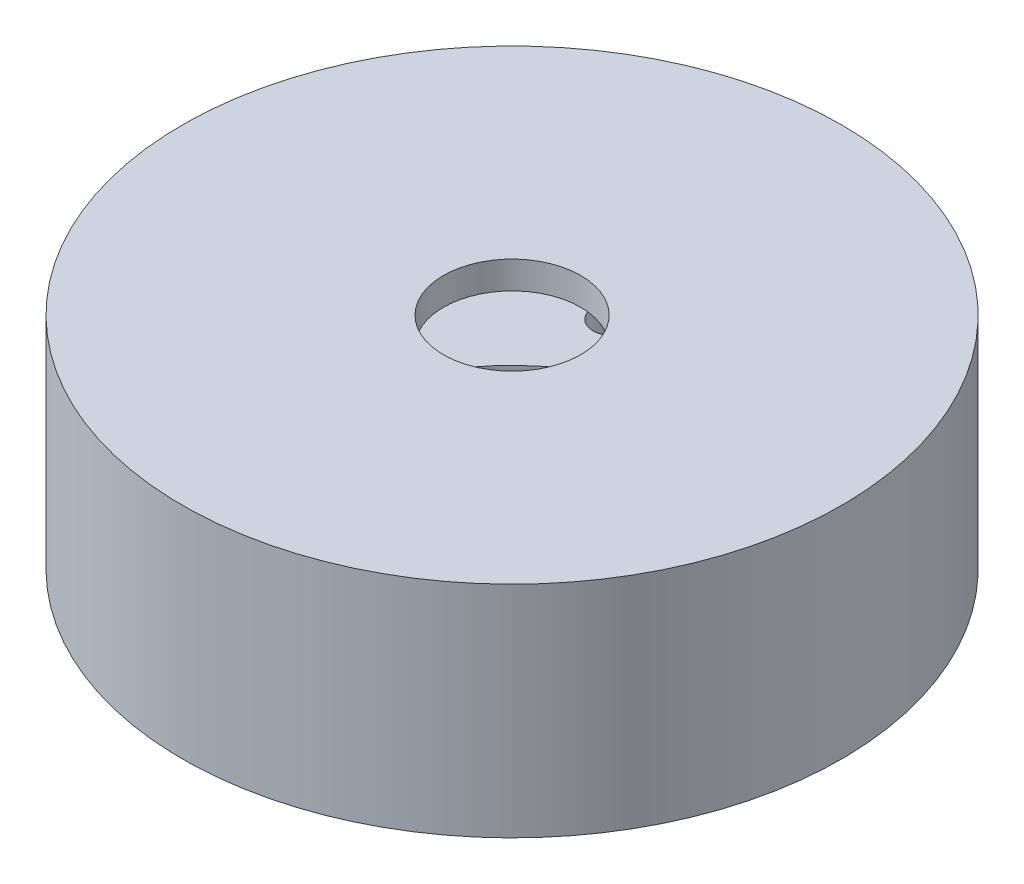
from build123d import *

# Parameters (mm, degrees)
SKETCH1_W          = 139.7
SKETCH1_H          = 12.7
SKETCH1_W_2        = 107.95
SKETCH1_H_2        = 12.744604202
CUT_EXTRUDE3_REACH = 240.273
SKETCH5_R          = 97.248113747
SKETCH5_R_2        = 9.267203016


with BuildPart() as part:
    # Sketch1 → Revolve1 (revolve)
    with BuildSketch(Plane.XY, mode=Mode.PRIVATE) as revolve1_sk:
        Polygon((-152.4, 0), (-139.7, 0), (-139.7, 12.7), (-139.7, 88.855395798), (-139.7, 101.6), (-152.4, 101.6), align=None)
        with Locations((-69.85, 6.35)):
            Rectangle(SKETCH1_W, SKETCH1_H)
        with Locations((-85.725, 95.227697899)):
            Rectangle(SKETCH1_W_2, SKETCH1_H_2)
    revolve(revolve1_sk.sketch.rotate(Axis((0, 50.8, 0), (0, 1, 0)), 270), axis=Axis((0, 50.8, 0), (0, 1, 0)))

    # Sketch5 → Cut-Extrude3 (cut, up to next)
    with BuildSketch(Plane.XZ, mode=Mode.PRIVATE) as cut_extrude3_sk1:
        with Locations(Location((0, 0, 0), (0, 0, 270))):
            Circle(SKETCH5_R)
    cut_extrude3_tool1 = extrude(cut_extrude3_sk1.sketch, amount=-CUT_EXTRUDE3_REACH, mode=Mode.PRIVATE) & part.part
    # Sketch5 → Cut-Extrude3 (cut, up to next)
    with BuildSketch(Plane.XZ, mode=Mode.PRIVATE) as cut_extrude3_sk2:
        with Locations(Location((127.67505098, 0, 0), (0, 0, 270))):
            Circle(SKETCH5_R_2)
    cut_extrude3_tool2 = extrude(cut_extrude3_sk2.sketch, amount=-CUT_EXTRUDE3_REACH, mode=Mode.PRIVATE) & part.part
    # Sketch5 → Cut-Extrude3 (cut, up to next)
    with BuildSketch(Plane.XZ, mode=Mode.PRIVATE) as cut_extrude3_sk3:
        with Locations(Location((63.83752549, -110.569837578, 0), (0, 0, 270))):
            Circle(SKETCH5_R_2)
    cut_extrude3_tool3 = extrude(cut_extrude3_sk3.sketch, amount=-CUT_EXTRUDE3_REACH, mode=Mode.PRIVATE) & part.part
    # Sketch5 → Cut-Extrude3 (cut, up to next)
    with BuildSketch(Plane.XZ, mode=Mode.PRIVATE) as cut_extrude3_sk4:
        with Locations(Location((-63.83752549, -110.569837578, 0), (0, 0, 270))):
            Circle(SKETCH5_R_2)
    cut_extrude3_tool4 = extrude(cut_extrude3_sk4.sketch, amount=-CUT_EXTRUDE3_REACH, mode=Mode.PRIVATE) & part.part
    # Sketch5 → Cut-Extrude3 (cut, up to next)
    with BuildSketch(Plane.XZ, mode=Mode.PRIVATE) as cut_extrude3_sk5:
        with Locations(Location((-127.67505098, 0, 0), (0, 0, 270))):
            Circle(SKETCH5_R_2)
    cut_extrude3_tool5 = extrude(cut_extrude3_sk5.sketch, amount=-CUT_EXTRUDE3_REACH, mode=Mode.PRIVATE) & part.part
    # Sketch5 → Cut-Extrude3 (cut, up to next)
    with BuildSketch(Plane.XZ, mode=Mode.PRIVATE) as cut_extrude3_sk6:
        with Locations(Location((-63.83752549, 110.569837578, 0), (0, 0, 270))):
            Circle(SKETCH5_R_2)
    cut_extrude3_tool6 = extrude(cut_extrude3_sk6.sketch, amount=-CUT_EXTRUDE3_REACH, mode=Mode.PRIVATE) & part.part
    # Sketch5 → Cut-Extrude3 (cut, up to next)
    with BuildSketch(Plane.XZ, mode=Mode.PRIVATE) as cut_extrude3_sk7:
        with Locations(Location((63.83752549, 110.569837578, 0), (0, 0, 270))):
            Circle(SKETCH5_R_2)
    cut_extrude3_tool7 = extrude(cut_extrude3_sk7.sketch, amount=-CUT_EXTRUDE3_REACH, mode=Mode.PRIVATE) & part.part
    add(cut_extrude3_tool1.solids().sort_by_distance((0, 0, 0))[0], mode=Mode.SUBTRACT)
    add(cut_extrude3_tool2.solids().sort_by_distance((127.675051, 0, 0))[0], mode=Mode.SUBTRACT)
    add(cut_extrude3_tool3.solids().sort_by_distance((63.837525, 0, -110.569838))[0], mode=Mode.SUBTRACT)
    add(cut_extrude3_tool4.solids().sort_by_distance((-63.837525, 0, -110.569838))[0], mode=Mode.SUBTRACT)
    add(cut_extrude3_tool5.solids().sort_by_distance((-127.675051, 0, 0))[0], mode=Mode.SUBTRACT)
    add(cut_extrude3_tool6.solids().sort_by_distance((-63.837525, 0, 110.569838))[0], mode=Mode.SUBTRACT)
    add(cut_extrude3_tool7.solids().sort_by_distance((63.837525, 0, 110.569838))[0], mode=Mode.SUBTRACT)


solid = part.part
